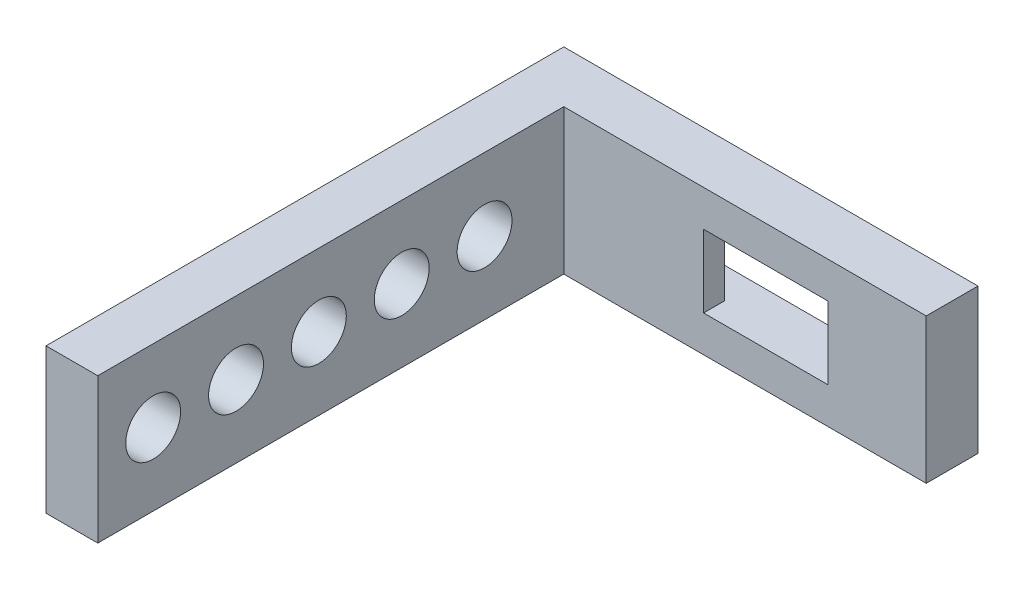
from build123d import *

# Parameters (mm, degrees)
BOSS_EXTRUDE1_DEPTH  = 14
SKETCH20_W           = 41
SKETCH20_H           = 14
BOSS_EXTRUDE10_DEPTH = 5
SKETCH21_R           = 2.65
CUT_EXTRUDE13_DEPTH  = 5
SKETCH22_W           = 5
SKETCH22_H           = 4
CUT_EXTRUDE14_DEPTH  = 59.966091951
SKETCH23_R           = 2.65
BOSS_EXTRUDE11_DEPTH = 5
SKETCH24_W           = 25
SKETCH24_H           = 7
CUT_EXTRUDE15_DEPTH  = 3
CUT_EXTRUDE16_REACH  = 65.285
SKETCH25_W           = 12
SKETCH25_H           = 7


with BuildPart() as part:
    # Sketch1 → Boss-Extrude1 (new body)
    with BuildSketch(Plane(origin=(0, 0, 0), x_dir=(1, 0, 0), z_dir=(0, 1, 0))):
        Polygon((6.589095597, 0), (10, 0), (10, 4), (40, 4), (40, 9), (11.589095597, 9), (0, 9), (0, 0), align=None)
    extrude(amount=BOSS_EXTRUDE1_DEPTH)

    # Sketch20 → Boss-Extrude10 (add)
    with BuildSketch(Plane.ZY):
        with Locations((20.5, 7)):
            Rectangle(SKETCH20_W, SKETCH20_H)
    extrude(amount=-BOSS_EXTRUDE10_DEPTH)

    # Sketch21 → Cut-Extrude13 (cut)
    with BuildSketch(Plane.ZY):
        with Locations((-4.35, 7)):
            Circle(SKETCH21_R)
        with Locations((3.65, 7)):
            Circle(SKETCH21_R)
        with Locations((11.65, 7)):
            Circle(SKETCH21_R)
        with Locations((19.65, 7)):
            Circle(SKETCH21_R)
        with Locations((27.65, 7)):
            Circle(SKETCH21_R)
        with Locations((35.65, 7)):
            Circle(SKETCH21_R)
    extrude(amount=-CUT_EXTRUDE13_DEPTH, mode=Mode.SUBTRACT)

    # Sketch22 → Cut-Extrude14 (cut, through all)
    with BuildSketch(Plane(origin=(0, 14, 0), x_dir=(1, 0, 0), z_dir=(0, 1, 0))):
        with Locations((7.5, 2)):
            Rectangle(SKETCH22_W, SKETCH22_H)
    extrude(amount=-CUT_EXTRUDE14_DEPTH, mode=Mode.SUBTRACT)

    # Sketch23 → Boss-Extrude11 (add)
    with BuildSketch(Plane.ZY):
        with Locations((-4.35, 7)):
            Circle(SKETCH23_R)
    extrude(amount=-BOSS_EXTRUDE11_DEPTH)

    # Sketch24 → Cut-Extrude15 (cut)
    with BuildSketch(Plane(origin=(0, 0, -9), x_dir=(-1, 0, 0), z_dir=(0, 0, -1))):
        with Locations((-24.5, 7)):
            Rectangle(SKETCH24_W, SKETCH24_H)
    extrude(amount=-CUT_EXTRUDE15_DEPTH, mode=Mode.SUBTRACT)

    # Sketch25 → Cut-Extrude16 (cut, up to next)
    with BuildSketch(Plane(origin=(0, 0, -6), x_dir=(-1, 0, 0), z_dir=(0, 0, -1)), mode=Mode.PRIVATE) as cut_extrude16_sk1:
        with Locations((-24.5, 7)):
            Rectangle(SKETCH25_W, SKETCH25_H)
    cut_extrude16_tool1 = extrude(cut_extrude16_sk1.sketch, amount=-CUT_EXTRUDE16_REACH, mode=Mode.PRIVATE) & part.part
    add(cut_extrude16_tool1.solids().sort_by_distance((24.5, 7, -6))[0], mode=Mode.SUBTRACT)


solid = part.part
